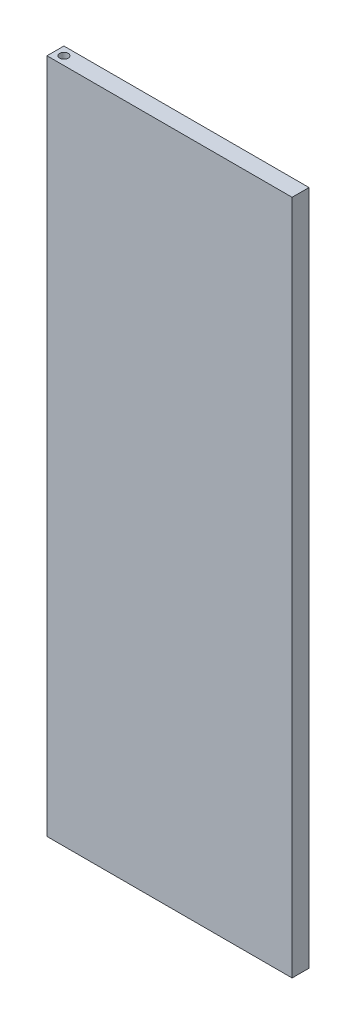
from build123d import *

# Parameters (mm, degrees)
SKETCH1_W           = 725
SKETCH1_H           = 50
BOSS_EXTRUDE1_DEPTH = 2000
SKETCH2_R           = 12.5
CUT_EXTRUDE1_DEPTH  = 100


with BuildPart() as part:
    # Sketch1 → Boss-Extrude1 (new body)
    with BuildSketch(Plane(origin=(0, 0, 0), x_dir=(1, 0, 0), z_dir=(0, 1, 0))):
        with Locations((-362.5, 25)):
            Rectangle(SKETCH1_W, SKETCH1_H)
    extrude(amount=-BOSS_EXTRUDE1_DEPTH)

    # Sketch2 → Cut-Extrude1 (cut)
    with BuildSketch(Plane(origin=(0, 0, 0), x_dir=(1, 0, 0), z_dir=(0, 1, 0))):
        with Locations(Location((-700, 25, 0), (0, 0, 270))):
            Circle(SKETCH2_R)
    extrude(amount=-CUT_EXTRUDE1_DEPTH, mode=Mode.SUBTRACT)


solid = part.part
